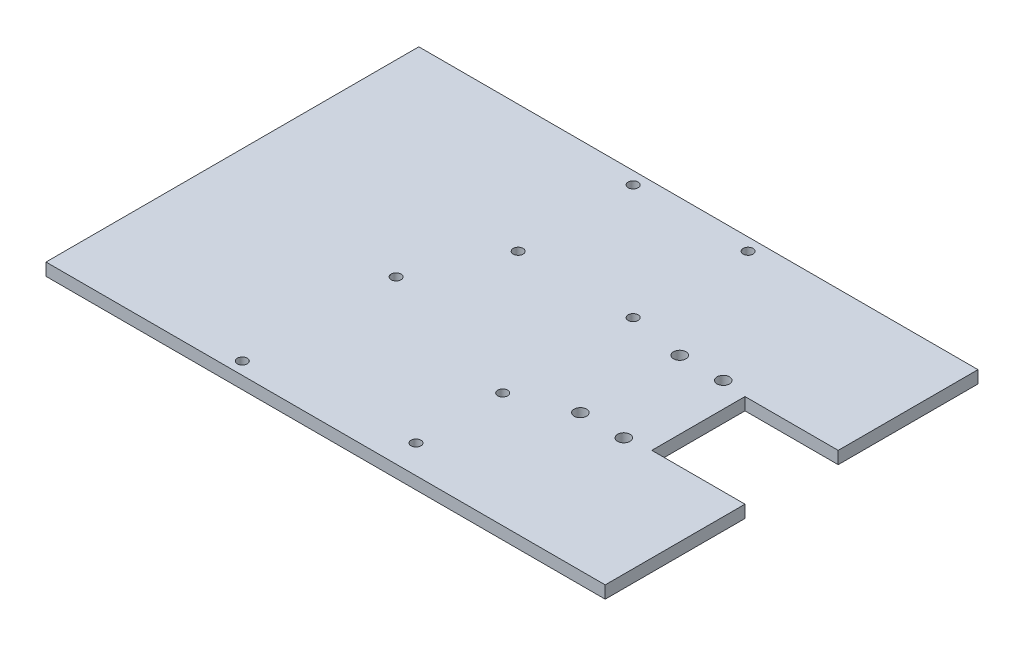
from build123d import *

# Parameters (mm, degrees)
SKETCH_1_W          = 180
SKETCH_1_H          = 120
EXTRUDE_1_DEPTH     = 4
SKETCH_3_W          = 40
SKETCH_3_H          = 30
CUT_EXTRUDE_2_DEPTH = 4
SKETCH_4_R          = 1.6
CUT_EXTRUDE_3_DEPTH = 4
SKETCH_5_R          = 1.6
CUT_EXTRUDE_4_DEPTH = 4
SKETCH_7_R          = 2
CUT_EXTRUDE_5_DEPTH = 10


with BuildPart() as part:
    # 草图1 → 凸台-拉伸1 (new body)
    with BuildSketch(Plane(origin=(0, 0, 0), x_dir=(1, 0, 0), z_dir=(0, 1, 0))):
        Rectangle(SKETCH_1_W, SKETCH_1_H)
    extrude(amount=EXTRUDE_1_DEPTH)

    # 草图3 → 切除-拉伸2 (cut)
    with BuildSketch(Plane(origin=(0, 4, 0), x_dir=(1, 0, 0), z_dir=(0, 1, 0))):
        with Locations((80, 0)):
            Rectangle(SKETCH_3_W, SKETCH_3_H)
    extrude(amount=-CUT_EXTRUDE_2_DEPTH, mode=Mode.SUBTRACT)

    # 草图4 → 切除-拉伸3 (cut)
    with BuildSketch(Plane(origin=(0, 4, 0), x_dir=(1, 0, 0), z_dir=(0, 1, 0))):
        with Locations(Location((-17, 56, 0), (0, 0, 270))):
            Circle(SKETCH_4_R)
        with Locations(Location((20, 56, 0), (0, 0, 270))):
            Circle(SKETCH_4_R)
        with Locations(Location((20, 19, 0), (0, 0, 270))):
            Circle(SKETCH_4_R)
        with Locations(Location((-17, 19, 0), (0, 0, 270))):
            Circle(SKETCH_4_R)
    extrude(amount=-CUT_EXTRUDE_3_DEPTH, mode=Mode.SUBTRACT)

    # 草图5 → 切除-拉伸4 (cut)
    with BuildSketch(Plane(origin=(0, 4, 0), x_dir=(1, 0, 0), z_dir=(0, 1, 0))):
        with Locations(Location((-29.5, -7.8, 0), (0, 0, 270))):
            Circle(SKETCH_5_R)
        with Locations(Location((20, -23, 0), (0, 0, 270))):
            Circle(SKETCH_5_R)
        with Locations(Location((20, -50.9, 0), (0, 0, 270))):
            Circle(SKETCH_5_R)
        with Locations(Location((-30.8, -56, 0), (0, 0, 270))):
            Circle(SKETCH_5_R)
    extrude(amount=-CUT_EXTRUDE_4_DEPTH, mode=Mode.SUBTRACT)

    # 草图7 → 切除-拉伸5 (cut)
    with BuildSketch(Plane.XZ):
        with Locations(Location((52, 16, 0), (0, 0, 270))):
            Circle(SKETCH_7_R)
        with Locations(Location((38, 16, 0), (0, 0, 270))):
            Circle(SKETCH_7_R)
        with Locations(Location((52, -16, 0), (0, 0, 270))):
            Circle(SKETCH_7_R)
        with Locations(Location((38, -16, 0), (0, 0, 270))):
            Circle(SKETCH_7_R)
    extrude(amount=-CUT_EXTRUDE_5_DEPTH, mode=Mode.SUBTRACT)


solid = part.part
